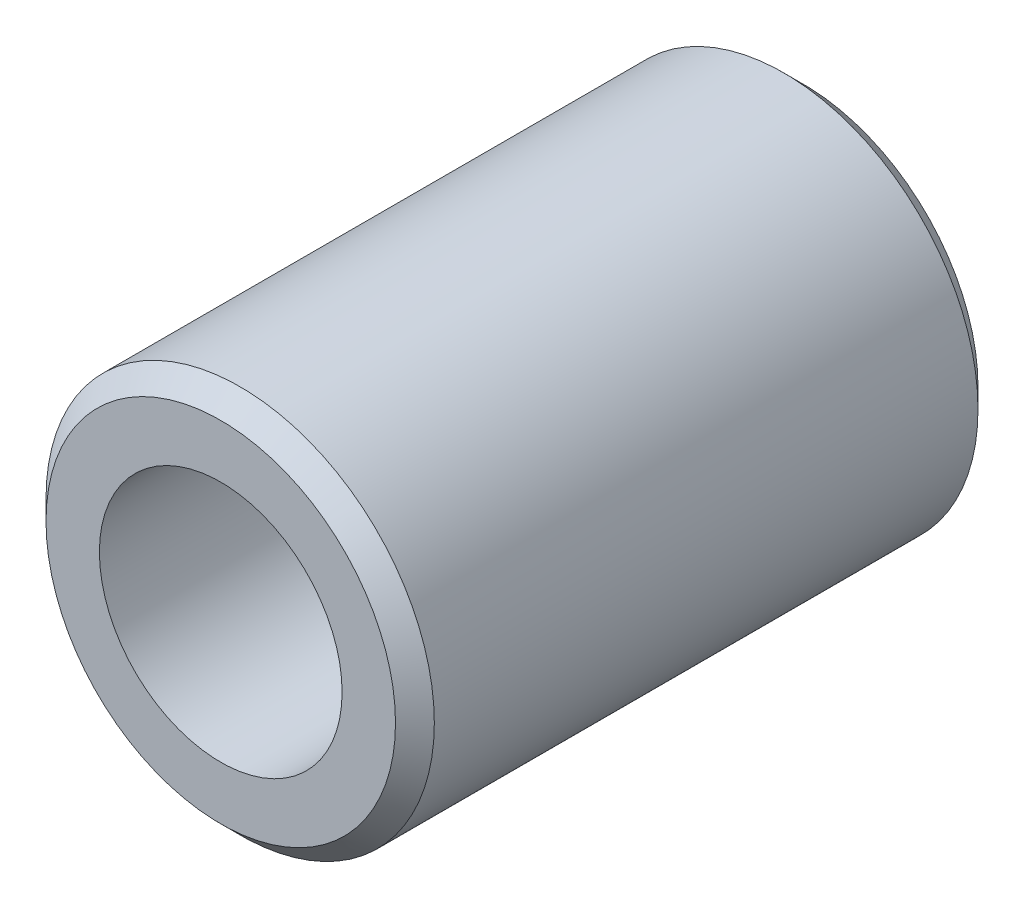
from build123d import *

# Parameters (mm, degrees)
SKETCH1_R           = 20
SKETCH1_R_2         = 12.5
BOSS_EXTRUDE1_DEPTH = 60
CHAMFER1_SIZE       = 2


with BuildPart() as part:
    # Sketch1 → Boss-Extrude1 (new body)
    with BuildSketch(Plane.XY):
        Circle(SKETCH1_R)
        Circle(SKETCH1_R_2, mode=Mode.SUBTRACT)
    extrude(amount=BOSS_EXTRUDE1_DEPTH)

    # Chamfer1
    chamfer1_edges = [part.edges().sort_by_distance(p)[0] for p in [
        (-20, 0, 0),
        (-20, 0, 60),
    ]]
    chamfer(chamfer1_edges, length=CHAMFER1_SIZE)


solid = part.part
